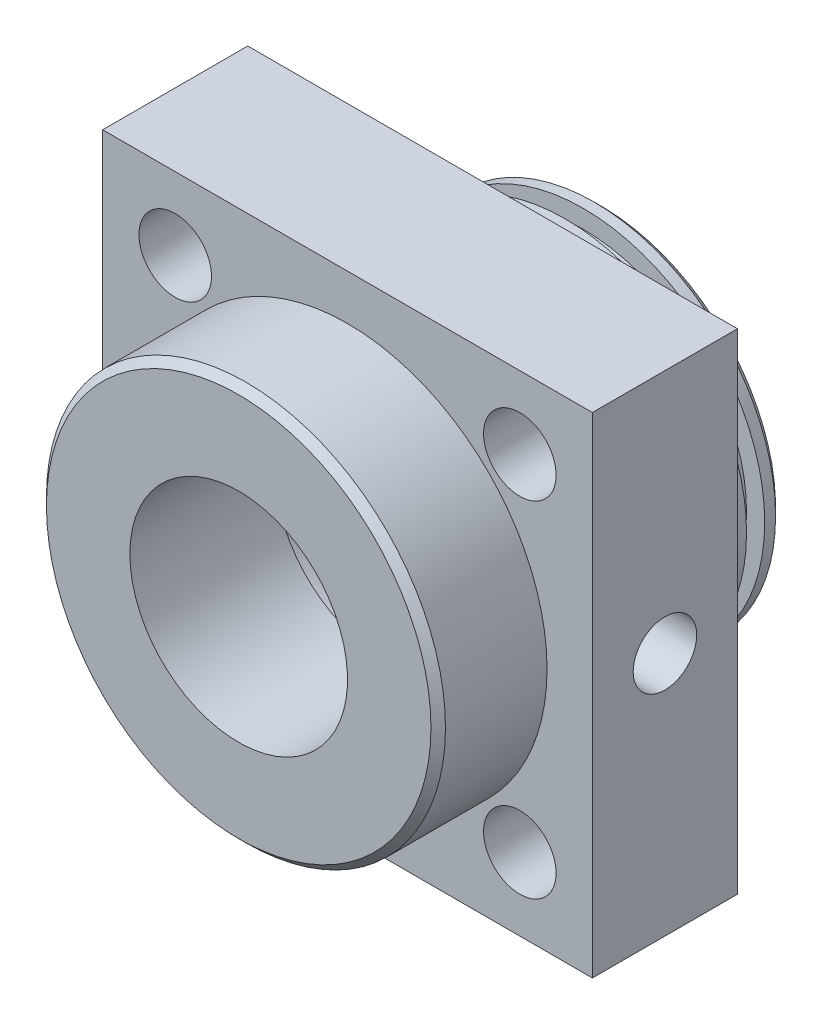
from build123d import *

# Parameters (mm, degrees)
SKETCH1_R              = 55
BOSS_EXTRUDE1_DEPTH    = 30
SKETCH2_W              = 135
SKETCH2_H              = 135
BOSS_EXTRUDE2_DEPTH    = 40
SKETCH3_R              = 10
CUT_EXTRUDE1_DEPTH     = 40
SKETCH4_R              = 50
BOSS_EXTRUDE3_DEPTH    = 20
SKETCH5_R              = 45
BOSS_EXTRUDE4_DEPTH    = 5
SKETCH6_R              = 50
BOSS_EXTRUDE5_DEPTH    = 5
CHAMFER1_SIZE          = 2
CHAMFER2_SIZE          = 2
M20X2_5_TAPPED_HOLE1_D = 17.5
SKETCH9_R              = 35
CUT_EXTRUDE2_DEPTH     = 60
SKETCH10_R             = 30
CUT_EXTRUDE3_DEPTH     = 113.749722951


with BuildPart() as part:
    # Sketch1 → Boss-Extrude1 (new body)
    with BuildSketch(Plane.XY):
        Circle(SKETCH1_R)
    extrude(amount=BOSS_EXTRUDE1_DEPTH)

    # Sketch2 → Boss-Extrude2 (add)
    with BuildSketch(Plane(origin=(0, 0, 0), x_dir=(-1, 0, 0), z_dir=(0, 0, -1))):
        Rectangle(SKETCH2_W, SKETCH2_H)
    extrude(amount=BOSS_EXTRUDE2_DEPTH)

    # Sketch3 → Cut-Extrude1 (cut)
    with BuildSketch(Plane(origin=(0, 0, -40), x_dir=(-1, 0, 0), z_dir=(0, 0, -1))):
        with Locations((-47.5, 47.5)):
            Circle(SKETCH3_R)
        with Locations(Location((47.5, 47.5, 0), (0, 0, 180))):
            Circle(SKETCH3_R)
        with Locations((47.5, -47.5)):
            Circle(SKETCH3_R)
        with Locations(Location((-47.5, -47.5, 0), (0, 0, 180))):
            Circle(SKETCH3_R)
    extrude(amount=-CUT_EXTRUDE1_DEPTH, mode=Mode.SUBTRACT)

    # Sketch4 → Boss-Extrude3 (add)
    with BuildSketch(Plane(origin=(0, 0, -40), x_dir=(-1, 0, 0), z_dir=(0, 0, -1))):
        Circle(SKETCH4_R)
    extrude(amount=BOSS_EXTRUDE3_DEPTH)

    # Sketch5 → Boss-Extrude4 (add)
    with BuildSketch(Plane(origin=(0, 0, -60), x_dir=(-1, 0, 0), z_dir=(0, 0, -1))):
        Circle(SKETCH5_R)
    extrude(amount=BOSS_EXTRUDE4_DEPTH)

    # Sketch6 → Boss-Extrude5 (add)
    with BuildSketch(Plane(origin=(0, 0, -65), x_dir=(-1, 0, 0), z_dir=(0, 0, -1))):
        Circle(SKETCH6_R)
    extrude(amount=BOSS_EXTRUDE5_DEPTH)

    # Chamfer1
    chamfer1_edges = [part.edges().sort_by_distance(p)[0] for p in [
        (-55, 0, 30),
    ]]
    chamfer(chamfer1_edges, length=CHAMFER1_SIZE)

    # Chamfer2
    chamfer2_edges = [part.edges().sort_by_distance(p)[0] for p in [
        (50, 0, -70),
    ]]
    chamfer(chamfer2_edges, length=CHAMFER2_SIZE)

    # M20x2.5 Tapped Hole1 (through all)
    with Locations(Plane.ZY.offset(67.5)):
        with Locations((-20, 0)):
            Hole(M20X2_5_TAPPED_HOLE1_D / 2)

    # Sketch9 → Cut-Extrude2 (cut)
    with BuildSketch(Plane(origin=(0, 0, -70), x_dir=(-1, 0, 0), z_dir=(0, 0, -1))):
        Circle(SKETCH9_R)
    extrude(amount=-CUT_EXTRUDE2_DEPTH, mode=Mode.SUBTRACT)

    # Sketch10 → Cut-Extrude3 (cut, through all)
    with BuildSketch(Plane(origin=(0, 0, -10), x_dir=(-1, 0, 0), z_dir=(0, 0, -1))):
        Circle(SKETCH10_R)
    extrude(amount=-CUT_EXTRUDE3_DEPTH, mode=Mode.SUBTRACT)


solid = part.part
